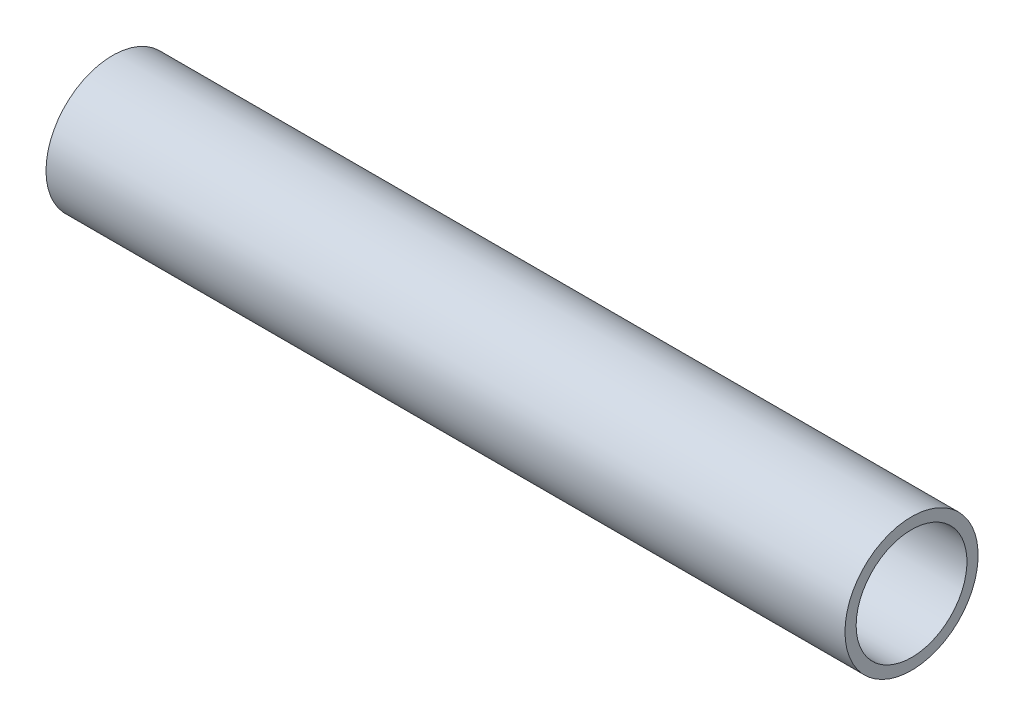
from build123d import *

# Parameters (mm, degrees)
SKETCH11_R              = 6.35
SKETCH11_R_2            = 5.2832
PIPE_0_5_SCH_40_1_DEPTH = 76.2


with BuildPart() as part:
    # Sketch11 → Pipe 0.5 SCH 40(1) (new body)
    with BuildSketch(Plane(origin=(101.402754267, 670.040757757, 0), x_dir=(0, -1, 0), z_dir=(-1, 0, 0))):
        Circle(SKETCH11_R)
        Circle(SKETCH11_R_2, mode=Mode.SUBTRACT)
    extrude(amount=PIPE_0_5_SCH_40_1_DEPTH)


solid = part.part
